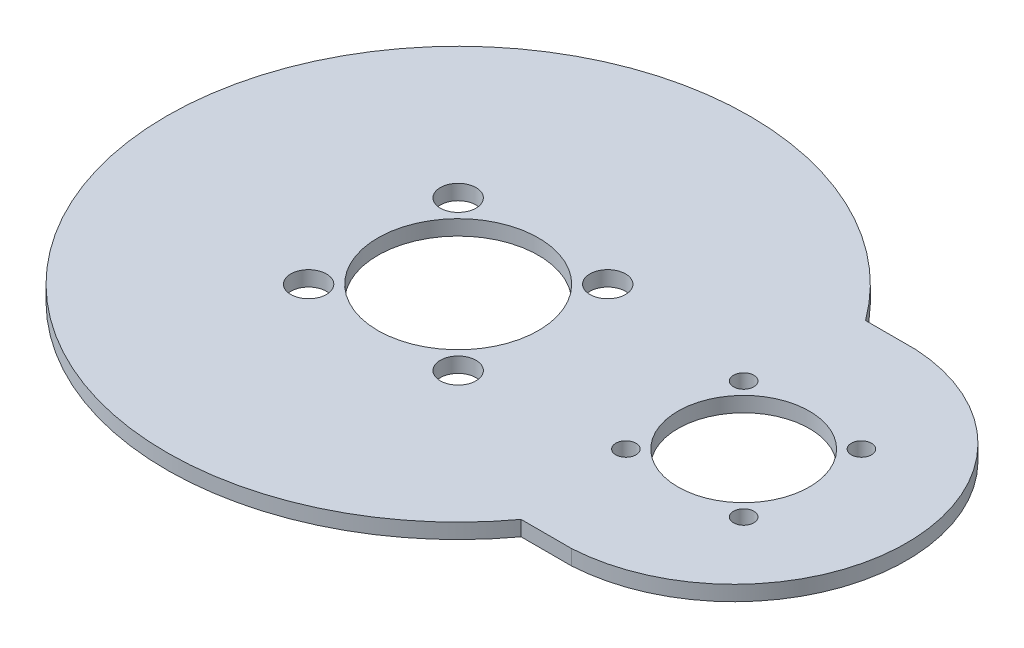
from build123d import *

# Parameters (mm, degrees)
SKETCH1_R           = 1.7
SKETCH1_R_2         = 13.5
SKETCH1_R_3         = 3
SKETCH1_R_4         = 11.05
BOSS_EXTRUDE1_DEPTH = 2.54


with BuildPart() as part:
    # Sketch1 → Boss-Extrude1 (new body)
    with BuildSketch(Plane(origin=(0, 0, 0), x_dir=(1, 0, 0), z_dir=(0, 1, 0))):
        with BuildLine():
            ThreePointArc((0, 49), (22.160822156, 43.702379356), (39.529822722, 28.955018831))
            Line((39.529822722, 28.955018831), (48, 28.955018831))
            ThreePointArc((48, 28.955018831), (75.385415079, 0), (48, -28.955018831))
            Line((48, -28.955018831), (39.529822722, -28.955018831))
            ThreePointArc((39.529822722, -28.955018831), (22.160822156, -43.702379356), (0, -49))
            ThreePointArc((0, -49), (-49, 0), (0, 49))
        make_face()
        with Locations(Location((38.100505063, -9.899494937, 0), (0, 0, 270))):
            Circle(SKETCH1_R, mode=Mode.SUBTRACT)
        with Locations(Location((57.899494937, -9.899494937, 0), (0, 0, 270))):
            Circle(SKETCH1_R, mode=Mode.SUBTRACT)
        with Locations(Location((57.899494937, 9.899494937, 0), (0, 0, 270))):
            Circle(SKETCH1_R, mode=Mode.SUBTRACT)
        with Locations(Location((38.100505063, 9.899494937, 0), (0, 0, 270))):
            Circle(SKETCH1_R, mode=Mode.SUBTRACT)
        with Locations(Location((0, 0, 0), (0, 0, 270))):
            Circle(SKETCH1_R_2, mode=Mode.SUBTRACT)
        with Locations(Location((-12.572358569, -12.572358569, 0), (0, 0, 270))):
            Circle(SKETCH1_R_3, mode=Mode.SUBTRACT)
        with Locations(Location((12.572358569, -12.572358569, 0), (0, 0, 270))):
            Circle(SKETCH1_R_3, mode=Mode.SUBTRACT)
        with Locations(Location((12.572358569, 12.572358569, 0), (0, 0, 270))):
            Circle(SKETCH1_R_3, mode=Mode.SUBTRACT)
        with Locations(Location((-12.572358569, 12.572358569, 0), (0, 0, 270))):
            Circle(SKETCH1_R_3, mode=Mode.SUBTRACT)
        with Locations(Location((48, 0, 0), (0, 0, 270))):
            Circle(SKETCH1_R_4, mode=Mode.SUBTRACT)
    extrude(amount=BOSS_EXTRUDE1_DEPTH)


solid = part.part
